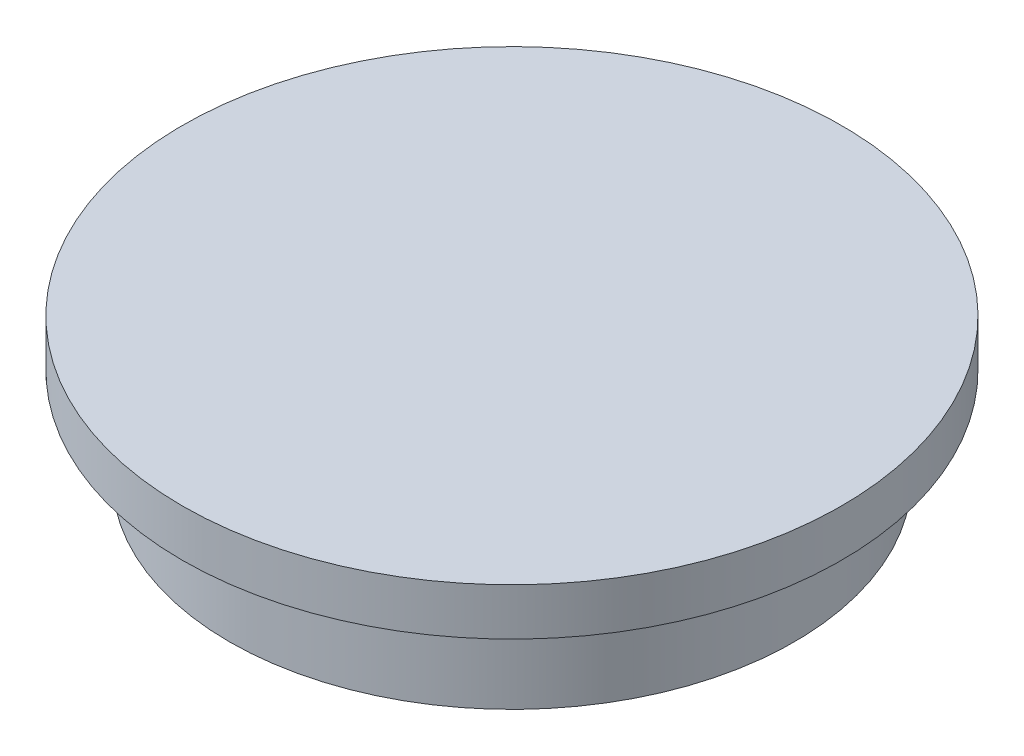
from build123d import *

# Parameters (mm, degrees)
SKETCH1_R           = 6
BOSS_EXTRUDE1_DEPTH = 2
SKETCH2_R           = 7
BOSS_EXTRUDE2_DEPTH = 1


with BuildPart() as part:
    # Sketch1 → Boss-Extrude1 (new body)
    with BuildSketch(Plane(origin=(0, 0, 0), x_dir=(1, 0, 0), z_dir=(0, 1, 0))):
        with Locations(Location((0, 0, 0), (0, 0, 270))):
            Circle(SKETCH1_R)
    extrude(amount=BOSS_EXTRUDE1_DEPTH)

    # Sketch2 → Boss-Extrude2 (add)
    with BuildSketch(Plane(origin=(0, 2, 0), x_dir=(1, 0, 0), z_dir=(0, 1, 0))):
        with Locations(Location((0, 0, 0), (0, 0, 270))):
            Circle(SKETCH2_R)
    extrude(amount=BOSS_EXTRUDE2_DEPTH)


solid = part.part
